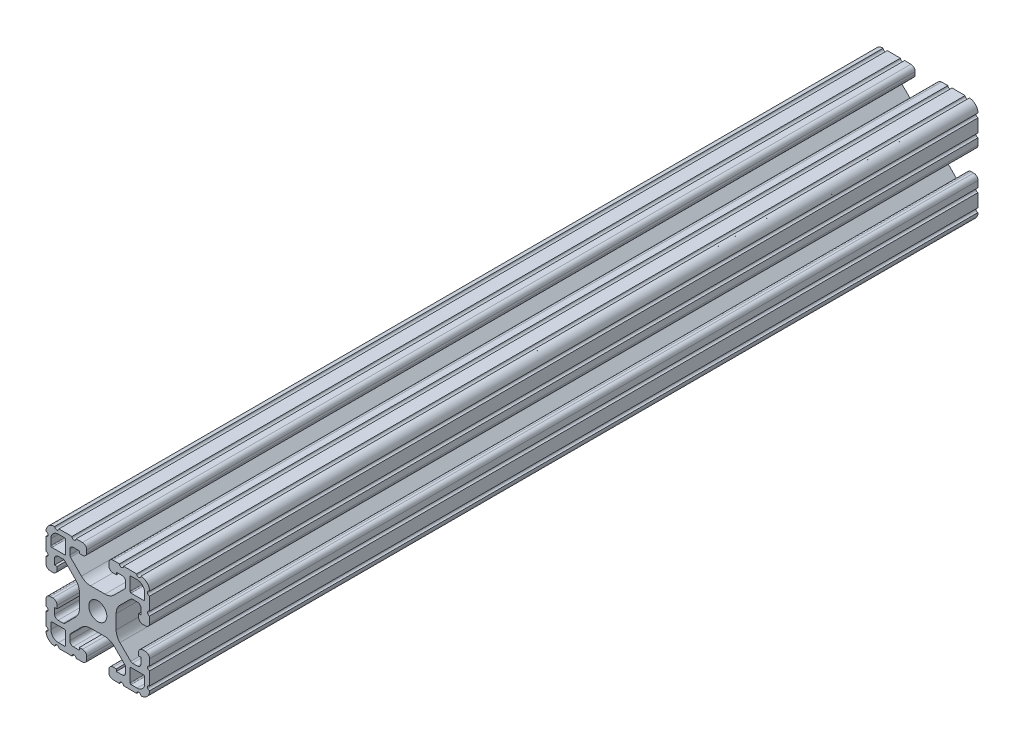
from build123d import *

# Parameters (mm, degrees)
SKETCH1_R      = 3.3274
EXTRUDE1_DEPTH = 304.8


with BuildPart() as part:
    # Sketch1 → Extrude1 (new body)
    with BuildSketch(Plane.XY):
        with BuildLine():
            Line((10.02670034, -12.151875049), (6.021451835, -8.147301292))
            ThreePointArc((6.021451835, -8.147301292), (4.48060392, -7.11788044), (2.663118988, -6.7564))
            Line((2.663118988, -6.7564), (-2.663118988, -6.7564))
            ThreePointArc((-2.663118988, -6.7564), (-4.48060392, -7.11788044), (-6.021451835, -8.147301292))
            Line((-6.021451835, -8.147301292), (-10.02670034, -12.151875049))
            ThreePointArc((-10.02670034, -12.151875049), (-10.219349756, -12.440155844), (-10.287, -12.78021916))
            Line((-10.287, -12.78021916), (-10.287, -14.55471092))
            ThreePointArc((-10.287, -14.55471092), (-9.915025612, -15.452736532), (-9.017, -15.82471092))
            Line((-9.017, -15.82471092), (-6.814144259, -15.82471092))
            Line((-6.814144259, -15.82471092), (-6.814144259, -14.986))
            Line((-6.814144259, -14.986), (-5.6388, -14.986))
            ThreePointArc((-5.6388, -14.986), (-4.525248241, -15.447248241), (-4.064, -16.5608))
            Line((-4.064, -16.5608), (-4.064, -17.4752))
            ThreePointArc((-4.064, -17.4752), (-4.525248241, -18.588751759), (-5.6388, -19.05))
            Line((-5.6388, -19.05), (-7.9756, -19.05))
            ThreePointArc((-7.9756, -19.05), (-8.7376, -18.288), (-9.4996, -19.05))
            Line((-9.4996, -19.05), (-14.3256, -19.05))
            ThreePointArc((-14.3256, -19.05), (-15.0876, -18.288), (-15.8496, -19.05))
            Line((-15.8496, -19.05), (-15.875, -19.05))
            ThreePointArc((-15.875, -19.05), (-18.12006403, -18.12006403), (-19.05, -15.875))
            Line((-19.05, -15.875), (-19.05, -15.8496))
            ThreePointArc((-19.05, -15.8496), (-18.288, -15.0876), (-19.05, -14.3256))
            Line((-19.05, -14.3256), (-19.05, -9.4996))
            ThreePointArc((-19.05, -9.4996), (-18.288, -8.7376), (-19.05, -7.9756))
            Line((-19.05, -7.9756), (-19.05, -5.6388))
            ThreePointArc((-19.05, -5.6388), (-18.588751759, -4.525248241), (-17.4752, -4.064))
            Line((-17.4752, -4.064), (-16.5608, -4.064))
            ThreePointArc((-16.5608, -4.064), (-15.447248241, -4.525248241), (-14.986, -5.6388))
            Line((-14.986, -5.6388), (-14.986, -6.750644259))
            Line((-14.986, -6.750644259), (-15.879033733, -6.750644259))
            Line((-15.879033733, -6.750644259), (-15.879033733, -8.919211783))
            ThreePointArc((-15.879033733, -8.919211783), (-15.507059345, -9.817237395), (-14.609033733, -10.189211783))
            Line((-14.609033733, -10.189211783), (-12.742784468, -10.189211783))
            ThreePointArc((-12.742784468, -10.189211783), (-12.402613491, -10.121555016), (-12.114219497, -9.928882664))
            Line((-12.114219497, -9.928882664), (-8.147867153, -5.963198517))
            ThreePointArc((-8.147867153, -5.963198517), (-7.118033561, -4.422154408), (-6.7564, -2.604299809))
            Line((-6.7564, -2.604299809), (-6.7564, 2.604299809))
            ThreePointArc((-6.7564, 2.604299809), (-7.118033561, 4.422154408), (-8.147867153, 5.963198517))
            Line((-8.147867153, 5.963198517), (-12.114219497, 9.928882664))
            ThreePointArc((-12.114219497, 9.928882664), (-12.402613491, 10.121555016), (-12.742784468, 10.189211783))
            Line((-12.742784468, 10.189211783), (-14.609033733, 10.189211783))
            ThreePointArc((-14.609033733, 10.189211783), (-15.507059345, 9.817237395), (-15.879033733, 8.919211783))
            Line((-15.879033733, 8.919211783), (-15.879033733, 6.750644259))
            Line((-15.879033733, 6.750644259), (-14.986, 6.750644259))
            Line((-14.986, 6.750644259), (-14.986, 5.6388))
            ThreePointArc((-14.986, 5.6388), (-15.447248241, 4.525248241), (-16.5608, 4.064))
            Line((-16.5608, 4.064), (-17.4752, 4.064))
            ThreePointArc((-17.4752, 4.064), (-18.588751759, 4.525248241), (-19.05, 5.6388))
            Line((-19.05, 5.6388), (-19.05, 7.9756))
            ThreePointArc((-19.05, 7.9756), (-18.288, 8.7376), (-19.05, 9.4996))
            Line((-19.05, 9.4996), (-19.05, 14.3256))
            ThreePointArc((-19.05, 14.3256), (-18.288, 15.0876), (-19.05, 15.8496))
            Line((-19.05, 15.8496), (-19.05, 15.875))
            ThreePointArc((-19.05, 15.875), (-18.12006403, 18.12006403), (-15.875, 19.05))
            Line((-15.875, 19.05), (-15.8496, 19.05))
            ThreePointArc((-15.8496, 19.05), (-15.0876, 18.288), (-14.3256, 19.05))
            Line((-14.3256, 19.05), (-9.4996, 19.05))
            ThreePointArc((-9.4996, 19.05), (-8.7376, 18.288), (-7.9756, 19.05))
            Line((-7.9756, 19.05), (-5.6388, 19.05))
            ThreePointArc((-5.6388, 19.05), (-4.525248241, 18.588751759), (-4.064, 17.4752))
            Line((-4.064, 17.4752), (-4.064, 16.5608))
            ThreePointArc((-4.064, 16.5608), (-4.525248241, 15.447248241), (-5.6388, 14.986))
            Line((-5.6388, 14.986), (-6.814144259, 14.986))
            Line((-6.814144259, 14.986), (-6.814144259, 15.82471092))
            Line((-6.814144259, 15.82471092), (-9.017, 15.82471092))
            ThreePointArc((-9.017, 15.82471092), (-9.915025612, 15.452736532), (-10.287, 14.55471092))
            Line((-10.287, 14.55471092), (-10.287, 12.78021916))
            ThreePointArc((-10.287, 12.78021916), (-10.219349756, 12.440155844), (-10.02670034, 12.151875049))
            Line((-10.02670034, 12.151875049), (-6.021451835, 8.147301292))
            ThreePointArc((-6.021451835, 8.147301292), (-4.48060392, 7.11788044), (-2.663118988, 6.7564))
            Line((-2.663118988, 6.7564), (2.663118988, 6.7564))
            ThreePointArc((2.663118988, 6.7564), (4.48060392, 7.11788044), (6.021451835, 8.147301292))
            Line((6.021451835, 8.147301292), (10.02670034, 12.151875049))
            ThreePointArc((10.02670034, 12.151875049), (10.219349756, 12.440155844), (10.287, 12.78021916))
            Line((10.287, 12.78021916), (10.287, 14.55471092))
            ThreePointArc((10.287, 14.55471092), (9.915025612, 15.452736532), (9.017, 15.82471092))
            Line((9.017, 15.82471092), (6.814144259, 15.82471092))
            Line((6.814144259, 15.82471092), (6.814144259, 14.986))
            Line((6.814144259, 14.986), (5.6388, 14.986))
            ThreePointArc((5.6388, 14.986), (4.525248241, 15.447248241), (4.064, 16.5608))
            Line((4.064, 16.5608), (4.064, 17.4752))
            ThreePointArc((4.064, 17.4752), (4.525248241, 18.588751759), (5.6388, 19.05))
            Line((5.6388, 19.05), (7.9756, 19.05))
            ThreePointArc((7.9756, 19.05), (8.7376, 18.288), (9.4996, 19.05))
            Line((9.4996, 19.05), (14.3256, 19.05))
            ThreePointArc((14.3256, 19.05), (15.0876, 18.288), (15.8496, 19.05))
            Line((15.8496, 19.05), (15.875, 19.05))
            ThreePointArc((15.875, 19.05), (18.12006403, 18.12006403), (19.05, 15.875))
            Line((19.05, 15.875), (19.05, 15.8496))
            ThreePointArc((19.05, 15.8496), (18.288, 15.0876), (19.05, 14.3256))
            Line((19.05, 14.3256), (19.05, 9.4996))
            ThreePointArc((19.05, 9.4996), (18.288, 8.7376), (19.05, 7.9756))
            Line((19.05, 7.9756), (19.05, 5.6388))
            ThreePointArc((19.05, 5.6388), (18.588751759, 4.525248241), (17.4752, 4.064))
            Line((17.4752, 4.064), (16.5608, 4.064))
            ThreePointArc((16.5608, 4.064), (15.447248241, 4.525248241), (14.986, 5.6388))
            Line((14.986, 5.6388), (14.986, 6.750644259))
            Line((14.986, 6.750644259), (15.879033733, 6.750644259))
            Line((15.879033733, 6.750644259), (15.879033733, 8.919211783))
            ThreePointArc((15.879033733, 8.919211783), (15.507059345, 9.817237395), (14.609033733, 10.189211783))
            Line((14.609033733, 10.189211783), (12.742784468, 10.189211783))
            ThreePointArc((12.742784468, 10.189211783), (12.402613491, 10.121555016), (12.114219497, 9.928882664))
            Line((12.114219497, 9.928882664), (8.147867153, 5.963198517))
            ThreePointArc((8.147867153, 5.963198517), (7.118033561, 4.422154408), (6.7564, 2.604299809))
            Line((6.7564, 2.604299809), (6.7564, -2.604299809))
            ThreePointArc((6.7564, -2.604299809), (7.118033561, -4.422154408), (8.147867153, -5.963198517))
            Line((8.147867153, -5.963198517), (12.114219497, -9.928882664))
            ThreePointArc((12.114219497, -9.928882664), (12.402613491, -10.121555016), (12.742784468, -10.189211783))
            Line((12.742784468, -10.189211783), (14.609033733, -10.189211783))
            ThreePointArc((14.609033733, -10.189211783), (15.507059345, -9.817237395), (15.879033733, -8.919211783))
            Line((15.879033733, -8.919211783), (15.879033733, -6.750644259))
            Line((15.879033733, -6.750644259), (14.986, -6.750644259))
            Line((14.986, -6.750644259), (14.986, -5.6388))
            ThreePointArc((14.986, -5.6388), (15.447248241, -4.525248241), (16.5608, -4.064))
            Line((16.5608, -4.064), (17.4752, -4.064))
            ThreePointArc((17.4752, -4.064), (18.588751759, -4.525248241), (19.05, -5.6388))
            Line((19.05, -5.6388), (19.05, -7.9756))
            ThreePointArc((19.05, -7.9756), (18.288, -8.7376), (19.05, -9.4996))
            Line((19.05, -9.4996), (19.05, -14.3256))
            ThreePointArc((19.05, -14.3256), (18.288, -15.0876), (19.05, -15.8496))
            Line((19.05, -15.8496), (19.05, -15.875))
            ThreePointArc((19.05, -15.875), (18.12006403, -18.12006403), (15.875, -19.05))
            Line((15.875, -19.05), (15.8496, -19.05))
            ThreePointArc((15.8496, -19.05), (15.0876, -18.288), (14.3256, -19.05))
            Line((14.3256, -19.05), (9.4996, -19.05))
            ThreePointArc((9.4996, -19.05), (8.7376, -18.288), (7.9756, -19.05))
            Line((7.9756, -19.05), (5.6388, -19.05))
            ThreePointArc((5.6388, -19.05), (4.525248241, -18.588751759), (4.064, -17.4752))
            Line((4.064, -17.4752), (4.064, -16.5608))
            ThreePointArc((4.064, -16.5608), (4.525248241, -15.447248241), (5.6388, -14.986))
            Line((5.6388, -14.986), (6.814144259, -14.986))
            Line((6.814144259, -14.986), (6.814144259, -15.82471092))
            Line((6.814144259, -15.82471092), (9.017, -15.82471092))
            ThreePointArc((9.017, -15.82471092), (9.915025612, -15.452736532), (10.287, -14.55471092))
            Line((10.287, -14.55471092), (10.287, -12.78021916))
            ThreePointArc((10.287, -12.78021916), (10.219349756, -12.440155844), (10.02670034, -12.151875049))
        make_face()
        Circle(SKETCH1_R, mode=Mode.SUBTRACT)
        with BuildLine():
            Line((16.891, -11.8618), (12.2428, -11.8618))
            ThreePointArc((12.2428, -11.8618), (11.973392316, -11.973392316), (11.8618, -12.2428))
            Line((11.8618, -12.2428), (11.8618, -16.891))
            ThreePointArc((11.8618, -16.891), (11.973392316, -17.160407684), (12.2428, -17.272))
            Line((12.2428, -17.272), (14.478, -17.272))
            ThreePointArc((14.478, -17.272), (16.453656347, -16.453656347), (17.272, -14.478))
            Line((17.272, -14.478), (17.272, -12.2428))
            ThreePointArc((17.272, -12.2428), (17.160407684, -11.973392316), (16.891, -11.8618))
        make_face(mode=Mode.SUBTRACT)
        with BuildLine():
            Line((17.272, 14.478), (17.272, 12.2428))
            ThreePointArc((17.272, 12.2428), (17.160407684, 11.973392316), (16.891, 11.8618))
            Line((16.891, 11.8618), (12.2428, 11.8618))
            ThreePointArc((12.2428, 11.8618), (11.973392316, 11.973392316), (11.8618, 12.2428))
            Line((11.8618, 12.2428), (11.8618, 16.891))
            ThreePointArc((11.8618, 16.891), (11.973392316, 17.160407684), (12.2428, 17.272))
            Line((12.2428, 17.272), (14.478, 17.272))
            ThreePointArc((14.478, 17.272), (16.453656347, 16.453656347), (17.272, 14.478))
        make_face(mode=Mode.SUBTRACT)
        with BuildLine():
            Line((-17.272, -14.478), (-17.272, -12.2428))
            ThreePointArc((-17.272, -12.2428), (-17.160407684, -11.973392316), (-16.891, -11.8618))
            Line((-16.891, -11.8618), (-12.2428, -11.8618))
            ThreePointArc((-12.2428, -11.8618), (-11.973392316, -11.973392316), (-11.8618, -12.2428))
            Line((-11.8618, -12.2428), (-11.8618, -16.891))
            ThreePointArc((-11.8618, -16.891), (-11.973392316, -17.160407684), (-12.2428, -17.272))
            Line((-12.2428, -17.272), (-14.478, -17.272))
            ThreePointArc((-14.478, -17.272), (-16.453656347, -16.453656347), (-17.272, -14.478))
        make_face(mode=Mode.SUBTRACT)
        with BuildLine():
            Line((-16.891, 11.8618), (-12.2428, 11.8618))
            ThreePointArc((-12.2428, 11.8618), (-11.973392316, 11.973392316), (-11.8618, 12.2428))
            Line((-11.8618, 12.2428), (-11.8618, 16.891))
            ThreePointArc((-11.8618, 16.891), (-11.973392316, 17.160407684), (-12.2428, 17.272))
            Line((-12.2428, 17.272), (-14.478, 17.272))
            ThreePointArc((-14.478, 17.272), (-16.453656347, 16.453656347), (-17.272, 14.478))
            Line((-17.272, 14.478), (-17.272, 12.2428))
            ThreePointArc((-17.272, 12.2428), (-17.160407684, 11.973392316), (-16.891, 11.8618))
        make_face(mode=Mode.SUBTRACT)
    extrude(amount=-EXTRUDE1_DEPTH)


solid = part.part
